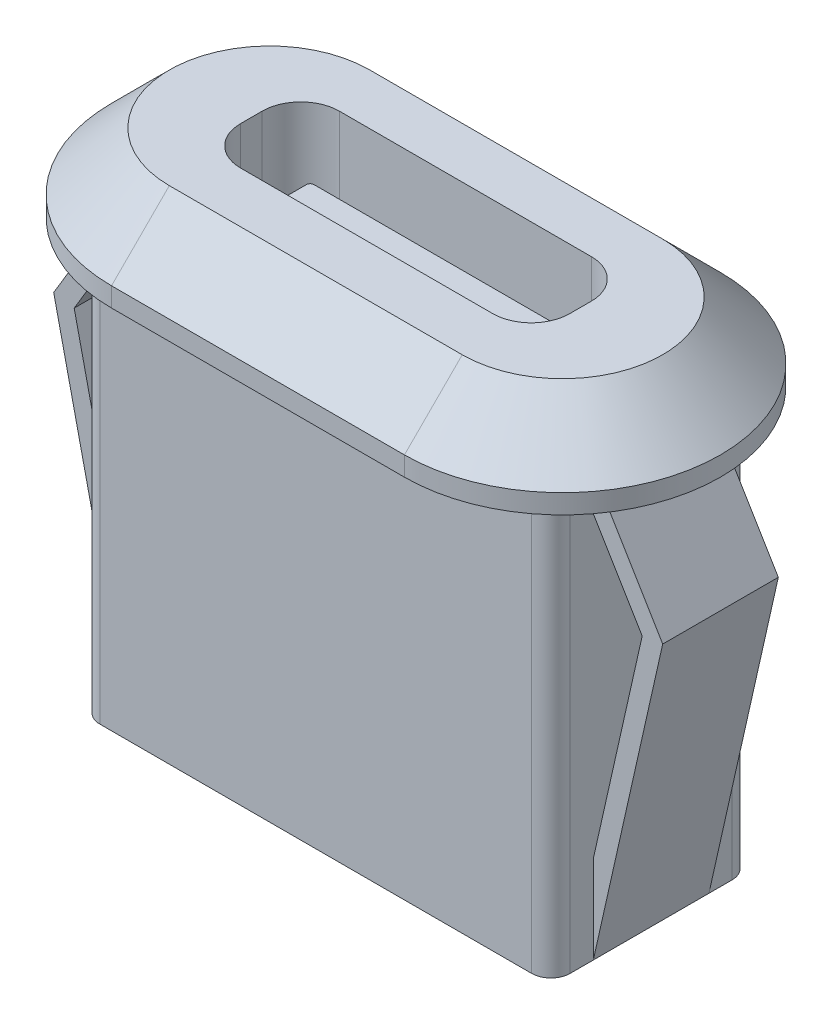
from build123d import *

# Parameters (mm, degrees)
SALIENTE_EXTRUIR1_DEPTH = 11
SALIENTE_EXTRUIR2_DEPTH = 0.5
SALIENTE_EXTRUIR3_DEPTH = 1.5
SALIENTE_EXTRUIR3_TAPER = 45
CORTAR_EXTRUIR1_DEPTH   = 6
CROQUIS7_W              = 6.69
CROQUIS7_H              = 1.2
SALIENTE_EXTRUIR4_DEPTH = 4.7
REDONDEO1_R             = 0.1
SALIENTE_EXTRUIR5_DEPTH = 1.5


with BuildPart() as part:
    # Croquis1 → Saliente-Extruir1 (new body)
    with BuildSketch(Plane(origin=(0, 0, 0), x_dir=(1, 0, 0), z_dir=(0, 1, 0))):
        with BuildLine():
            Line((-5.6, -2.6), (5.6, -2.6))
            ThreePointArc((5.6, -2.6), (5.953553391, -2.453553391), (6.1, -2.1))
            Line((6.1, -2.1), (6.1, 2.1))
            ThreePointArc((6.1, 2.1), (5.953553391, 2.453553391), (5.6, 2.6))
            Line((5.6, 2.6), (-5.6, 2.6))
            ThreePointArc((-5.6, 2.6), (-5.953553391, 2.453553391), (-6.1, 2.1))
            Line((-6.1, 2.1), (-6.1, -2.1))
            ThreePointArc((-6.1, -2.1), (-5.953553391, -2.453553391), (-5.6, -2.6))
        make_face()
    extrude(amount=-SALIENTE_EXTRUIR1_DEPTH)

    # Croquis2 → Saliente-Extruir2 (add)
    with BuildSketch(Plane(origin=(0, 0, 0), x_dir=(1, 0, 0), z_dir=(0, 1, 0))):
        with BuildLine():
            Line((-3.8, -4.1), (3.8, -4.1))
            ThreePointArc((3.8, -4.1), (7.9, 0), (3.8, 4.1))
            Line((3.8, 4.1), (-3.8, 4.1))
            ThreePointArc((-3.8, 4.1), (-7.9, 0), (-3.8, -4.1))
        make_face()
    extrude(amount=SALIENTE_EXTRUIR2_DEPTH)

    # Croquis3 → Saliente-Extruir3 (add)
    with BuildSketch(Plane(origin=(0, 0.5, 0), x_dir=(1, 0, 0), z_dir=(0, 1, 0))):
        with BuildLine():
            Line((-3.8, -4.1), (3.8, -4.1))
            ThreePointArc((3.8, -4.1), (7.9, 0), (3.8, 4.1))
            Line((3.8, 4.1), (-3.8, 4.1))
            ThreePointArc((-3.8, 4.1), (-7.9, 0), (-3.8, -4.1))
        make_face()
    extrude(amount=SALIENTE_EXTRUIR3_DEPTH, taper=SALIENTE_EXTRUIR3_TAPER)

    # Croquis6 → Cortar-Extruir1 (cut)
    with BuildSketch(Plane(origin=(0, 2, 0), x_dir=(1, 0, 0), z_dir=(0, 1, 0))):
        with BuildLine():
            Line((-3.27, 1.28), (3.27, 1.28))
            ThreePointArc((3.27, 1.28), (3.977106781, 0.987106781), (4.27, 0.28))
            Line((4.27, 0.28), (4.27, -0.28))
            ThreePointArc((4.27, -0.28), (3.977106781, -0.987106781), (3.27, -1.28))
            Line((3.27, -1.28), (-3.27, -1.28))
            ThreePointArc((-3.27, -1.28), (-3.977106781, -0.987106781), (-4.27, -0.28))
            Line((-4.27, -0.28), (-4.27, 0.28))
            ThreePointArc((-4.27, 0.28), (-3.977106781, 0.987106781), (-3.27, 1.28))
        make_face()
    extrude(amount=-CORTAR_EXTRUIR1_DEPTH, mode=Mode.SUBTRACT)

    # Croquis7 → Saliente-Extruir4 (add)
    with BuildSketch(Plane(origin=(0, -4, 0), x_dir=(1, 0, 0), z_dir=(0, 1, 0))):
        Rectangle(CROQUIS7_W, CROQUIS7_H)
    extrude(amount=SALIENTE_EXTRUIR4_DEPTH)

    # Redondeo1
    redondeo1_edges = [part.edges().sort_by_distance(p)[0] for p in [
        (3.345, -1.65, 0.6),
        (3.345, -1.65, -0.6),
        (-3.345, -1.65, -0.6),
        (-3.345, -1.65, 0.6),
    ]]
    fillet(redondeo1_edges, radius=REDONDEO1_R)

    # Croquis8 → Saliente-Extruir5 (add, symmetric)
    with BuildSketch(Plane.XY):
        Polygon((-6.1, 0), (-7.9, -3), (-6.1, -11), (-6.1, -8.722222222), (-7.368246767, -3.085569927), (-6.1, -0.971825316), align=None)
        Polygon((6.1, -0.971825316), (6.1, 0), (7.9, -3), (6.1, -11), (6.1, -8.722222222), (7.368246767, -3.085569927), align=None)
    extrude(amount=SALIENTE_EXTRUIR5_DEPTH, both=True)


solid = part.part
